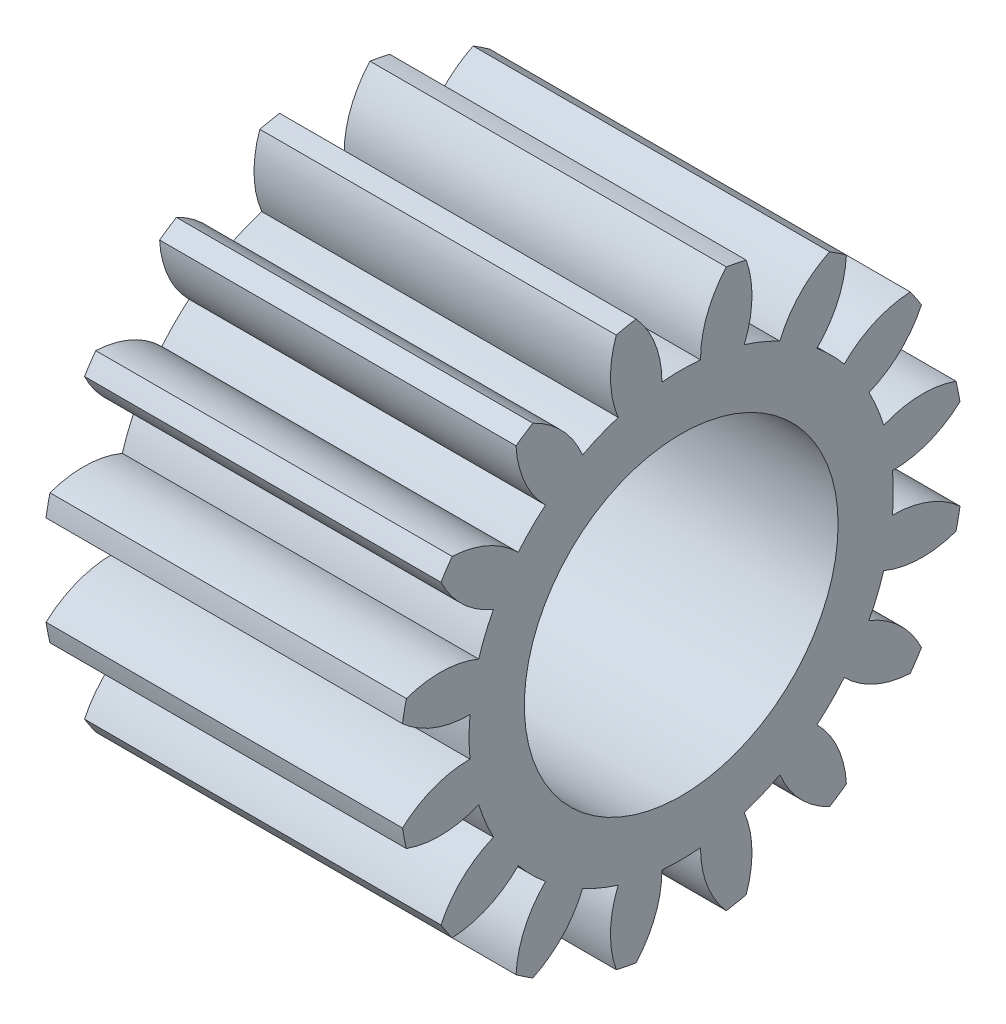
from build123d import *

# Parameters (mm, degrees)
SKETCH1_W                   = 14.4272
SKETCH1_H                   = 11.43
CUT_EXTRUDE1_DEPTH          = 22.666423328
CUT_EXTRUDE2_DEPTH          = 22.666423328
CUT_EXTRUDE3_DEPTH          = 22.666423328
CUT_EXTRUDE4_DEPTH          = 22.666423328
CUT_EXTRUDE5_DEPTH          = 22.666423328
CUT_EXTRUDE6_DEPTH          = 22.666423328
CUT_EXTRUDE7_DEPTH          = 22.666423328
CUT_EXTRUDE8_DEPTH          = 22.666423328
CUT_EXTRUDE9_DEPTH          = 22.666423328
CUT_EXTRUDE10_DEPTH         = 22.666423328
CUT_EXTRUDE11_DEPTH         = 22.666423328
CUT_EXTRUDE12_DEPTH         = 22.589197779
CUT_EXTRUDE13_DEPTH         = 22.589197779
CUT_EXTRUDE14_DEPTH         = 22.589197779
CUT_EXTRUDE15_DEPTH         = 22.589197779
CUT_EXTRUDE16_DEPTH         = 22.511694997
F_1_4_0_25_DIAMETER_HOLE1_D = 12.7


with BuildPart() as part:
    # Sketch1 → Revolve1 (revolve)
    with BuildSketch(Plane(origin=(0, 0, 0), x_dir=(-1, 0, 0), z_dir=(0, 0, -1)), mode=Mode.PRIVATE) as revolve1_sk:
        with Locations((-7.2136, 5.715)):
            Rectangle(SKETCH1_W, SKETCH1_H)
    revolve(revolve1_sk.sketch.rotate(Axis((14.4272, 0, 0), (-1, 0, 0)), 270), axis=Axis((14.4272, 0, 0), (-1, 0, 0)))

    # Sketch2 → Cut-Extrude1 (cut, through all)
    with BuildSketch(Plane(origin=(14.4272, 0, 0), x_dir=(0, 0, -1), z_dir=(1, 0, 0))):
        with BuildLine():
            ThreePointArc((9.270604538, 6.685865052), (8.082230509, 8.082230509), (6.685865052, 9.270604538))
            ThreePointArc((6.685865052, 9.270604538), (6.338531077, 7.823071544), (5.493243318, 6.597722098))
            ThreePointArc((5.493243318, 6.597722098), (6.070653138, 6.070653138), (6.597722098, 5.493243318))
            ThreePointArc((6.597722098, 5.493243318), (7.823071544, 6.338531077), (9.270604538, 6.685865052))
        make_face()
    extrude(amount=-CUT_EXTRUDE1_DEPTH, mode=Mode.SUBTRACT)

    # Sketch3 → Cut-Extrude2 (cut, through all)
    with BuildSketch(Plane(origin=(14.4272, 0, 0), x_dir=(0, 0, -1), z_dir=(1, 0, 0))):
        with BuildLine():
            ThreePointArc((11.123491573, 2.629227114), (10.559943057, 4.374071632), (9.724640644, 6.006352))
            ThreePointArc((9.724640644, 6.006352), (8.849798999, 4.801924852), (7.599934007, 3.9933272))
            ThreePointArc((7.599934007, 3.9933272), (7.931690563, 3.285413804), (8.197673616, 2.550256131))
            ThreePointArc((8.197673616, 2.550256131), (9.65322651, 2.862279258), (11.123491573, 2.629227114))
        make_face()
    extrude(amount=-CUT_EXTRUDE2_DEPTH, mode=Mode.SUBTRACT)

    # Sketch4 → Cut-Extrude3 (cut, through all)
    with BuildSketch(Plane(origin=(14.4272, 0, 0), x_dir=(0, 0, -1), z_dir=(1, 0, 0))):
        with BuildLine():
            ThreePointArc((11.282927851, -1.827686818), (11.43, 0), (11.282927851, 1.827686818))
            ThreePointArc((11.282927851, 1.827686818), (10.013765246, 1.049728631), (8.549603637, 0.780984435))
            ThreePointArc((8.549603637, 0.780984435), (8.5852, 0), (8.549603637, -0.780984435))
            ThreePointArc((8.549603637, -0.780984435), (10.013765246, -1.049728631), (11.282927851, -1.827686818))
        make_face()
    extrude(amount=-CUT_EXTRUDE3_DEPTH, mode=Mode.SUBTRACT)

    # Sketch5 → Cut-Extrude4 (cut, through all)
    with BuildSketch(Plane(origin=(14.4272, 0, 0), x_dir=(0, 0, -1), z_dir=(1, 0, 0))):
        with BuildLine():
            ThreePointArc((9.724640644, -6.006352), (10.559943057, -4.374071632), (11.123491573, -2.629227114))
            ThreePointArc((11.123491573, -2.629227114), (9.65322651, -2.862279258), (8.197673616, -2.550256131))
            ThreePointArc((8.197673616, -2.550256131), (7.931690563, -3.285413804), (7.599934007, -3.9933272))
            ThreePointArc((7.599934007, -3.9933272), (8.849798999, -4.801924852), (9.724640644, -6.006352))
        make_face()
    extrude(amount=-CUT_EXTRUDE4_DEPTH, mode=Mode.SUBTRACT)

    # Sketch6 → Cut-Extrude5 (cut, through all)
    with BuildSketch(Plane(origin=(14.4272, 0, 0), x_dir=(0, 0, -1), z_dir=(1, 0, 0))):
        with BuildLine():
            ThreePointArc((6.685865052, -9.270604538), (8.082230509, -8.082230509), (9.270604538, -6.685865052))
            ThreePointArc((9.270604538, -6.685865052), (7.823071544, -6.338531077), (6.597722098, -5.493243318))
            ThreePointArc((6.597722098, -5.493243318), (6.070653138, -6.070653138), (5.493243318, -6.597722098))
            ThreePointArc((5.493243318, -6.597722098), (6.338531077, -7.823071544), (6.685865052, -9.270604538))
        make_face()
    extrude(amount=-CUT_EXTRUDE5_DEPTH, mode=Mode.SUBTRACT)

    # Sketch7 → Cut-Extrude6 (cut, through all)
    with BuildSketch(Plane(origin=(14.4272, 0, 0), x_dir=(0, 0, -1), z_dir=(1, 0, 0))):
        with BuildLine():
            ThreePointArc((2.629227114, -11.123491573), (4.374071632, -10.559943057), (6.006352, -9.724640644))
            ThreePointArc((6.006352, -9.724640644), (4.801924852, -8.849798999), (3.9933272, -7.599934007))
            ThreePointArc((3.9933272, -7.599934007), (3.285413804, -7.931690563), (2.550256131, -8.197673616))
            ThreePointArc((2.550256131, -8.197673616), (2.862279258, -9.65322651), (2.629227114, -11.123491573))
        make_face()
    extrude(amount=-CUT_EXTRUDE6_DEPTH, mode=Mode.SUBTRACT)

    # Sketch8 → Cut-Extrude7 (cut, through all)
    with BuildSketch(Plane(origin=(14.4272, 0, 0), x_dir=(0, 0, -1), z_dir=(1, 0, 0))):
        with BuildLine():
            ThreePointArc((-1.827686818, -11.282927851), (0, -11.43), (1.827686818, -11.282927851))
            ThreePointArc((1.827686818, -11.282927851), (1.049728631, -10.013765246), (0.780984435, -8.549603637))
            ThreePointArc((0.780984435, -8.549603637), (0, -8.5852), (-0.780984435, -8.549603637))
            ThreePointArc((-0.780984435, -8.549603637), (-1.049728631, -10.013765246), (-1.827686818, -11.282927851))
        make_face()
    extrude(amount=-CUT_EXTRUDE7_DEPTH, mode=Mode.SUBTRACT)

    # Sketch9 → Cut-Extrude8 (cut, through all)
    with BuildSketch(Plane(origin=(14.4272, 0, 0), x_dir=(0, 0, -1), z_dir=(1, 0, 0))):
        with BuildLine():
            ThreePointArc((-6.006352, -9.724640644), (-4.374071632, -10.559943057), (-2.629227114, -11.123491573))
            ThreePointArc((-2.629227114, -11.123491573), (-2.862279258, -9.65322651), (-2.550256131, -8.197673616))
            ThreePointArc((-2.550256131, -8.197673616), (-3.285413804, -7.931690563), (-3.9933272, -7.599934007))
            ThreePointArc((-3.9933272, -7.599934007), (-4.801924852, -8.849798999), (-6.006352, -9.724640644))
        make_face()
    extrude(amount=-CUT_EXTRUDE8_DEPTH, mode=Mode.SUBTRACT)

    # Sketch10 → Cut-Extrude9 (cut, through all)
    with BuildSketch(Plane(origin=(14.4272, 0, 0), x_dir=(0, 0, -1), z_dir=(1, 0, 0))):
        with BuildLine():
            ThreePointArc((-9.270604538, -6.685865052), (-8.082230509, -8.082230509), (-6.685865052, -9.270604538))
            ThreePointArc((-6.685865052, -9.270604538), (-6.338531077, -7.823071544), (-5.493243318, -6.597722098))
            ThreePointArc((-5.493243318, -6.597722098), (-6.070653138, -6.070653138), (-6.597722098, -5.493243318))
            ThreePointArc((-6.597722098, -5.493243318), (-7.823071544, -6.338531077), (-9.270604538, -6.685865052))
        make_face()
    extrude(amount=-CUT_EXTRUDE9_DEPTH, mode=Mode.SUBTRACT)

    # Sketch11 → Cut-Extrude10 (cut, through all)
    with BuildSketch(Plane(origin=(14.4272, 0, 0), x_dir=(0, 0, -1), z_dir=(1, 0, 0))):
        with BuildLine():
            ThreePointArc((-11.123491573, -2.629227114), (-10.559943057, -4.374071632), (-9.724640644, -6.006352))
            ThreePointArc((-9.724640644, -6.006352), (-8.849798999, -4.801924852), (-7.599934007, -3.9933272))
            ThreePointArc((-7.599934007, -3.9933272), (-7.931690563, -3.285413804), (-8.197673616, -2.550256131))
            ThreePointArc((-8.197673616, -2.550256131), (-9.65322651, -2.862279258), (-11.123491573, -2.629227114))
        make_face()
    extrude(amount=-CUT_EXTRUDE10_DEPTH, mode=Mode.SUBTRACT)

    # Sketch12 → Cut-Extrude11 (cut, through all)
    with BuildSketch(Plane(origin=(14.4272, 0, 0), x_dir=(0, 0, -1), z_dir=(1, 0, 0))):
        with BuildLine():
            ThreePointArc((-11.282927851, 1.827686818), (-11.43, 0), (-11.282927851, -1.827686818))
            ThreePointArc((-11.282927851, -1.827686818), (-10.013765246, -1.049728631), (-8.549603637, -0.780984435))
            ThreePointArc((-8.549603637, -0.780984435), (-8.5852, 0), (-8.549603637, 0.780984435))
            ThreePointArc((-8.549603637, 0.780984435), (-10.013765246, 1.049728631), (-11.282927851, 1.827686818))
        make_face()
    extrude(amount=-CUT_EXTRUDE11_DEPTH, mode=Mode.SUBTRACT)

    # Sketch13 → Cut-Extrude12 (cut, through all)
    with BuildSketch(Plane(origin=(14.4272, 0, 0), x_dir=(0, 0, -1), z_dir=(1, 0, 0))):
        with BuildLine():
            ThreePointArc((-9.724640644, 6.006352), (-10.559943057, 4.374071632), (-11.123491573, 2.629227114))
            ThreePointArc((-11.123491573, 2.629227114), (-9.65322651, 2.862279258), (-8.197673616, 2.550256131))
            ThreePointArc((-8.197673616, 2.550256131), (-7.931690563, 3.285413804), (-7.599934007, 3.9933272))
            ThreePointArc((-7.599934007, 3.9933272), (-8.849798999, 4.801924852), (-9.724640644, 6.006352))
        make_face()
    extrude(amount=-CUT_EXTRUDE12_DEPTH, mode=Mode.SUBTRACT)

    # Sketch14 → Cut-Extrude13 (cut, through all)
    with BuildSketch(Plane(origin=(14.4272, 0, 0), x_dir=(0, 0, -1), z_dir=(1, 0, 0))):
        with BuildLine():
            ThreePointArc((-6.685865052, 9.270604538), (-8.082230509, 8.082230509), (-9.270604538, 6.685865052))
            ThreePointArc((-9.270604538, 6.685865052), (-7.823071544, 6.338531077), (-6.597722098, 5.493243318))
            ThreePointArc((-6.597722098, 5.493243318), (-6.070653138, 6.070653138), (-5.493243318, 6.597722098))
            ThreePointArc((-5.493243318, 6.597722098), (-6.338531077, 7.823071544), (-6.685865052, 9.270604538))
        make_face()
    extrude(amount=-CUT_EXTRUDE13_DEPTH, mode=Mode.SUBTRACT)

    # Sketch15 → Cut-Extrude14 (cut, through all)
    with BuildSketch(Plane(origin=(14.4272, 0, 0), x_dir=(0, 0, -1), z_dir=(1, 0, 0))):
        with BuildLine():
            ThreePointArc((-2.629227114, 11.123491573), (-4.374071632, 10.559943057), (-6.006352, 9.724640644))
            ThreePointArc((-6.006352, 9.724640644), (-4.801924852, 8.849798999), (-3.9933272, 7.599934007))
            ThreePointArc((-3.9933272, 7.599934007), (-3.285413804, 7.931690563), (-2.550256131, 8.197673616))
            ThreePointArc((-2.550256131, 8.197673616), (-2.862279258, 9.65322651), (-2.629227114, 11.123491573))
        make_face()
    extrude(amount=-CUT_EXTRUDE14_DEPTH, mode=Mode.SUBTRACT)

    # Sketch16 → Cut-Extrude15 (cut, through all)
    with BuildSketch(Plane(origin=(14.4272, 0, 0), x_dir=(0, 0, -1), z_dir=(1, 0, 0))):
        with BuildLine():
            ThreePointArc((1.827686818, 11.282927851), (0, 11.43), (-1.827686818, 11.282927851))
            ThreePointArc((-1.827686818, 11.282927851), (-1.049728631, 10.013765246), (-0.780984435, 8.549603637))
            ThreePointArc((-0.780984435, 8.549603637), (0, 8.5852), (0.780984435, 8.549603637))
            ThreePointArc((0.780984435, 8.549603637), (1.049728631, 10.013765246), (1.827686818, 11.282927851))
        make_face()
    extrude(amount=-CUT_EXTRUDE15_DEPTH, mode=Mode.SUBTRACT)

    # Sketch17 → Cut-Extrude16 (cut, through all)
    with BuildSketch(Plane(origin=(14.4272, 0, 0), x_dir=(0, 0, -1), z_dir=(1, 0, 0))):
        with BuildLine():
            ThreePointArc((6.006352, 9.724640644), (4.374071632, 10.559943057), (2.629227114, 11.123491573))
            ThreePointArc((2.629227114, 11.123491573), (2.862279258, 9.65322651), (2.550256131, 8.197673616))
            ThreePointArc((2.550256131, 8.197673616), (3.285413804, 7.931690563), (3.9933272, 7.599934007))
            ThreePointArc((3.9933272, 7.599934007), (4.801924852, 8.849798999), (6.006352, 9.724640644))
        make_face()
    extrude(amount=-CUT_EXTRUDE16_DEPTH, mode=Mode.SUBTRACT)

    # 1/4 (0.25) Diameter Hole1 (through all)
    with Locations(Plane(origin=(14.4272, 0, 0), x_dir=(0, 0, -1), z_dir=(1, 0, 0))):
        with Locations((0, 0)):
            Hole(F_1_4_0_25_DIAMETER_HOLE1_D / 2)


solid = part.part
